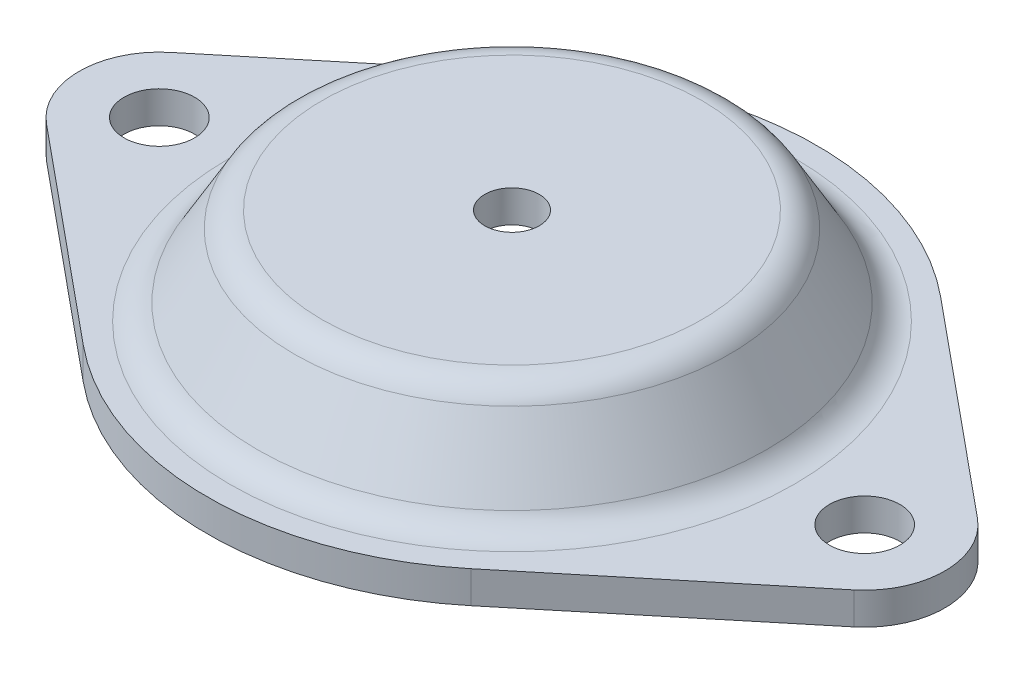
from build123d import *

# Parameters (mm, degrees)
ZAOKR_GLENIE1_R                 = 5
SZKIC2_R                        = 5.5
WYTNIJ_WYCI_GNI_CIE1_DEPTH      = 98.532046016
OTW_R_GWINTOWANY_M101_D         = 8.5
OTW_R_GWINTOWANY_M101_DEPTH     = 17.5
OTW_R_GWINTOWANY_M101_TIP       = 2.553657631
WYTNIJ_WYCI_GNI_CIE2_DEPTH      = 97.63074045
WYTNIJ_WYCI_GNI_CIE2_DEPTH_BACK = 97.63074045
SZKIC5_OUTSIDE_W                = 175.392
SZKIC5_OUTSIDE_H                = 175.392


with BuildPart() as part:
    # Szkic1 → Obrót1 (revolve)
    with BuildSketch(Plane.XY, mode=Mode.PRIVATE) as obr_t1_sk:
        Polygon((0, 0), (-32.5, 0), (-41.160254038, -15), (-67.5, -15), (-67.5, -20), (-38.273502692, -20), (-29.613248654, -5), (0, -5), align=None)
    revolve(obr_t1_sk.sketch.rotate(Axis((0, 100.333333333, 0), (0, -1, 0)), 270), axis=Axis((0, 100.333333333, 0), (0, -1, 0)))

    # Zaokrąglenie1
    zaokr_glenie1_edges = [part.edges().sort_by_distance(p)[0] for p in [
        (0, -5, -29.613248654),
        (0, -20, -38.273502692),
        (0, -15, -41.160254038),
        (0, 0, -32.5),
    ]]
    fillet(zaokr_glenie1_edges, radius=ZAOKR_GLENIE1_R)

    # Szkic2 → Wytnij-wyciągnięcie1 (cut, through all)
    with BuildSketch(Plane(origin=(0, 0, 0), x_dir=(1, 0, 0), z_dir=(0, 1, 0))):
        with Locations(Location((-55, 0, 0), (0, 0, 270))):
            Circle(SZKIC2_R)
        with Locations(Location((55, 0, 0), (0, 0, 270))):
            Circle(SZKIC2_R)
    extrude(amount=-WYTNIJ_WYCI_GNI_CIE1_DEPTH, mode=Mode.SUBTRACT)

    # Otwór gwintowany M101
    with Locations(Plane(origin=(0, 0, 0), x_dir=(1, 0, 0), z_dir=(0, 1, 0))):
        with Locations((0, 0)):
            Hole(OTW_R_GWINTOWANY_M101_D / 2, depth=OTW_R_GWINTOWANY_M101_DEPTH)
            with Locations((0, 0, -(OTW_R_GWINTOWANY_M101_DEPTH + OTW_R_GWINTOWANY_M101_TIP / 2))):  # 118° drill point
                Cone(0, OTW_R_GWINTOWANY_M101_D / 2, OTW_R_GWINTOWANY_M101_TIP, mode=Mode.SUBTRACT)

    # Szkic5 outside → Wytnij-wyciągnięcie2 (cut, two sides: drawn at the far end of the back side and taken through both)
    with BuildSketch(Plane(origin=(0, -15, 0), x_dir=(1, 0, 0), z_dir=(0, 1, 0)).offset(-WYTNIJ_WYCI_GNI_CIE2_DEPTH_BACK)):
        Rectangle(SZKIC5_OUTSIDE_W, SZKIC5_OUTSIDE_H)
        with BuildLine():
            Line((62.954545455, 9.642365198), (30.227272727, 36.640987752))
            ThreePointArc((30.227272727, 36.640987752), (0, 47.5), (-30.227272727, 36.640987752))
            Line((-30.227272727, 36.640987752), (-62.954545455, 9.642365198))
            ThreePointArc((-62.954545455, 9.642365198), (-67.5, 0), (-62.954545455, -9.642365198))
            Line((-62.954545455, -9.642365198), (-30.227272727, -36.640987752))
            ThreePointArc((-30.227272727, -36.640987752), (0, -47.5), (30.227272727, -36.640987752))
            Line((30.227272727, -36.640987752), (62.954545455, -9.642365198))
            ThreePointArc((62.954545455, -9.642365198), (67.5, 0), (62.954545455, 9.642365198))
        make_face(mode=Mode.SUBTRACT)
    extrude(amount=WYTNIJ_WYCI_GNI_CIE2_DEPTH + WYTNIJ_WYCI_GNI_CIE2_DEPTH_BACK, mode=Mode.SUBTRACT)


solid = part.part
